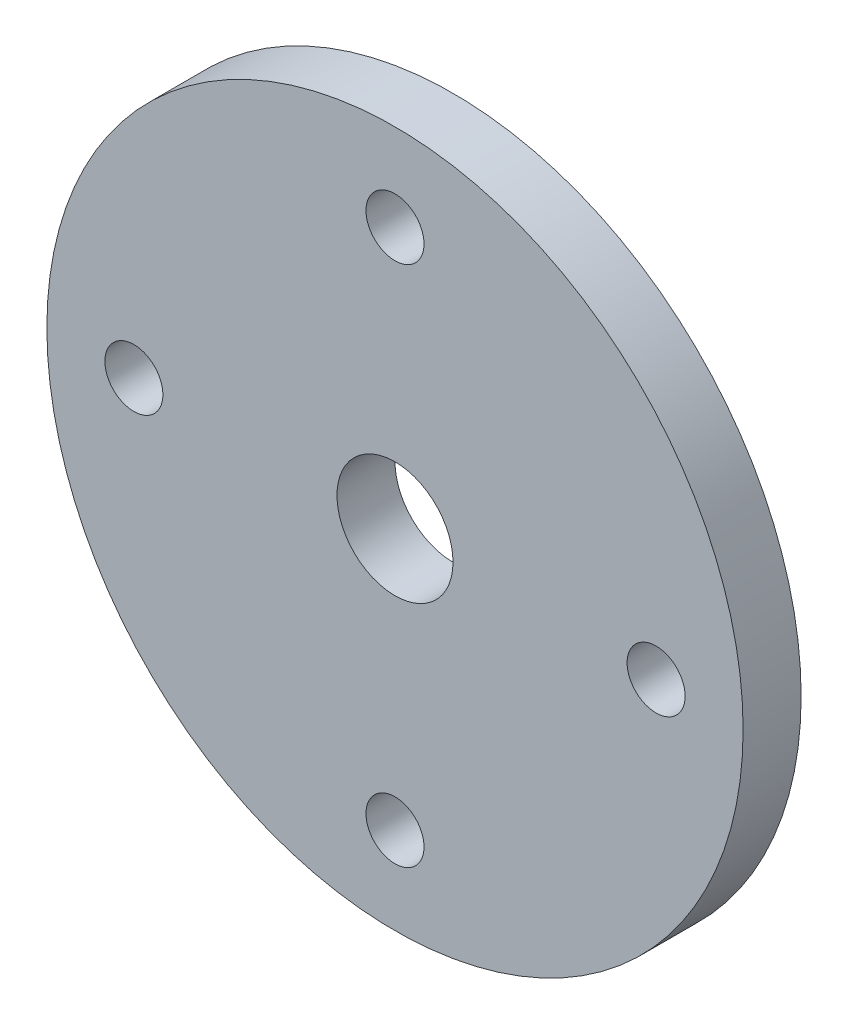
from build123d import *

# Parameters (mm, degrees)
SKETCH_1_R             = 30
EXTRUDE_1_DEPTH        = 5
SKETCH_2_R             = 5
CUT_EXTRUDE_1_DEPTH    = 93
HOLE_WIZARD_M6_1_D     = 5
HOLE_WIZARD_M6_1_DEPTH = 15
HOLE_WIZARD_M6_1_TIP   = 1.502151548


with BuildPart() as part:
    # 草图1 → 凸台-拉伸1 (new body)
    with BuildSketch(Plane.XY):
        Circle(SKETCH_1_R)
    extrude(amount=EXTRUDE_1_DEPTH)

    # 草图2 → 切除-拉伸1 (cut)
    with BuildSketch(Plane.XY.offset(5)):
        Circle(SKETCH_2_R)
    extrude(amount=-CUT_EXTRUDE_1_DEPTH, mode=Mode.SUBTRACT)

    # M6 螺纹孔1
    with Locations(Plane.XY.offset(5)):
        with Locations((22.5, 0), (0, 22.5), (0, -22.5), (-22.5, 0)):
            Hole(HOLE_WIZARD_M6_1_D / 2, depth=HOLE_WIZARD_M6_1_DEPTH)
            with Locations((0, 0, -(HOLE_WIZARD_M6_1_DEPTH + HOLE_WIZARD_M6_1_TIP / 2))):  # 118° drill point
                Cone(0, HOLE_WIZARD_M6_1_D / 2, HOLE_WIZARD_M6_1_TIP, mode=Mode.SUBTRACT)


solid = part.part
